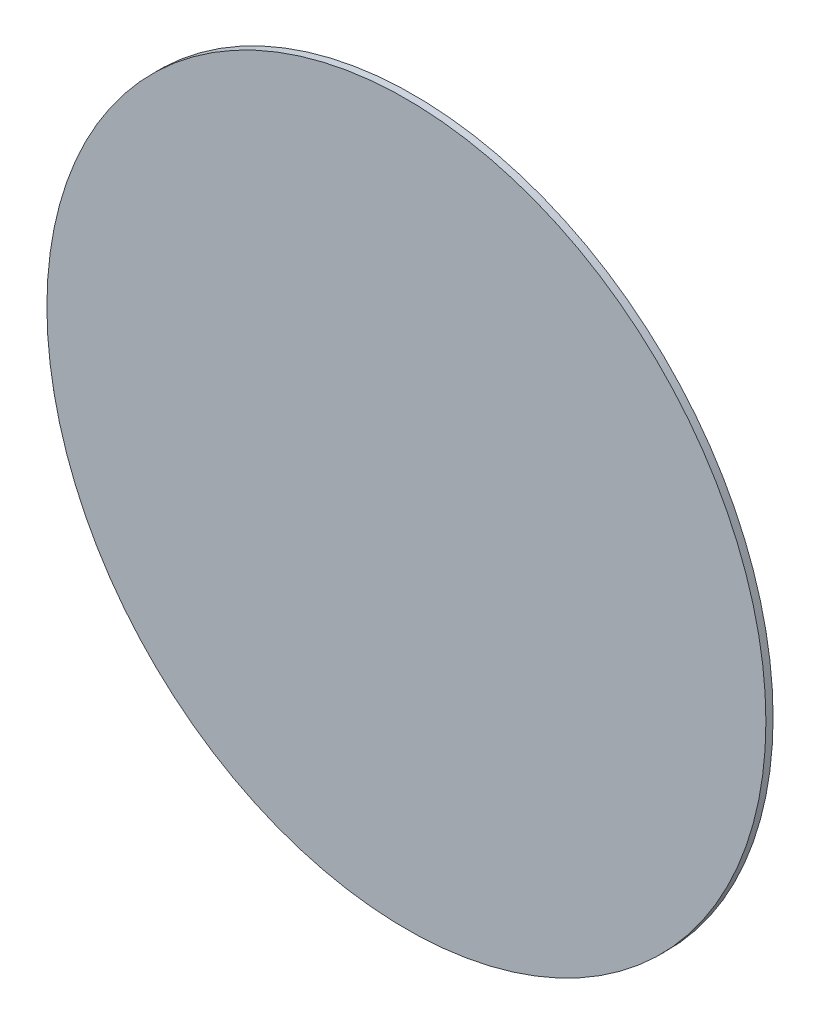
from build123d import *

# Parameters (mm, degrees)
SKETCH_1_R      = 500
EXTRUDE_1_DEPTH = 10


with BuildPart() as part:
    # 草图1 → 凸台-拉伸1 (new body)
    with BuildSketch(Plane.XY):
        Circle(SKETCH_1_R)
    extrude(amount=EXTRUDE_1_DEPTH)


solid = part.part
